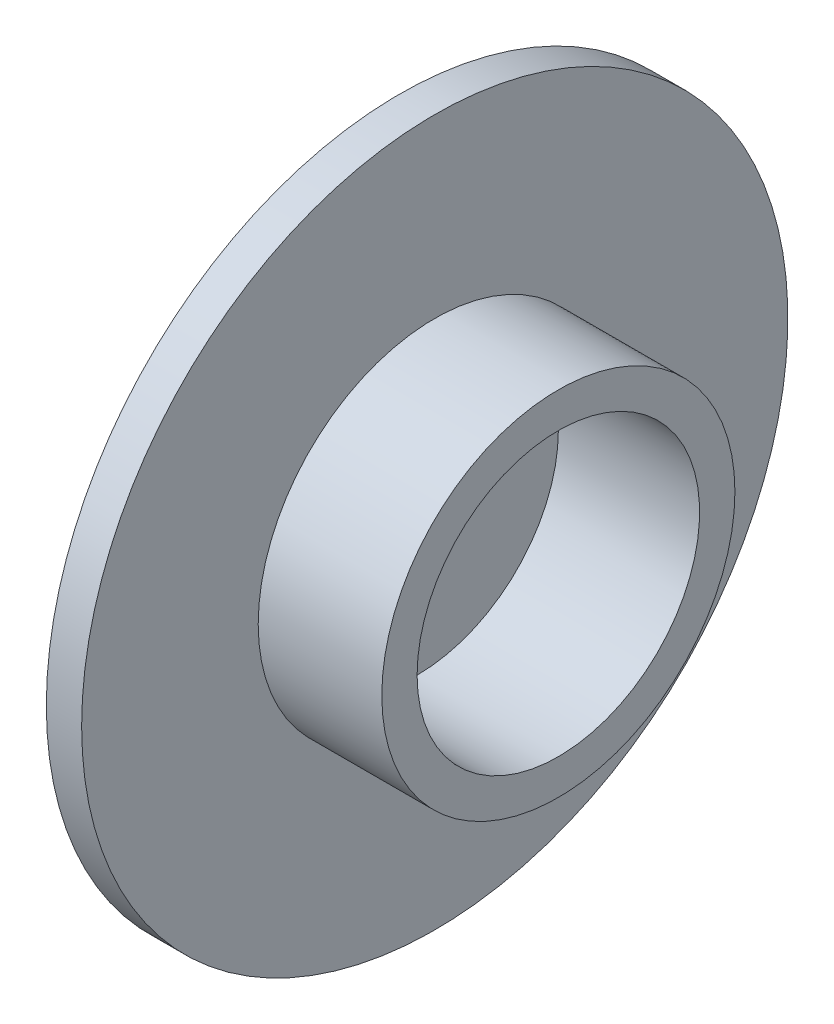
from build123d import *

# Parameters (mm, degrees)
BOSS_EXTRUDE1_START = -9
SKETCH2_R           = 10
BOSS_EXTRUDE1_DEPTH = 1


with BuildPart() as part:
    # Sketch1 → Revolve1 (revolve)
    with BuildSketch(Plane.XY, mode=Mode.PRIVATE) as revolve1_sk:
        Polygon((0.905904645, 10.418424893), (2.905904645, 10.418424893), (2.905904645, 0.418424893), (9.905904645, 0.418424893), (9.905904645, -1.581575107), (0.905904645, -1.581575107), (0.905904645, 8.418424893), align=None)
    revolve(revolve1_sk.sketch.rotate(Axis((0.905904645, -9.581575107, 0), (1, 0, 0)), 90), axis=Axis((0.905904645, -9.581575107, 0), (1, 0, 0)))

    # Sketch2 → Boss-Extrude1 (add)
    with BuildSketch(Plane(origin=(9.905904645, 0, 0), x_dir=(0, 0, -1), z_dir=(1, 0, 0)).offset(BOSS_EXTRUDE1_START)):
        with Locations(Location((0, -9.581575107, 0), (0, 0, 180))):
            Circle(SKETCH2_R)
    extrude(amount=BOSS_EXTRUDE1_DEPTH)


solid = part.part
